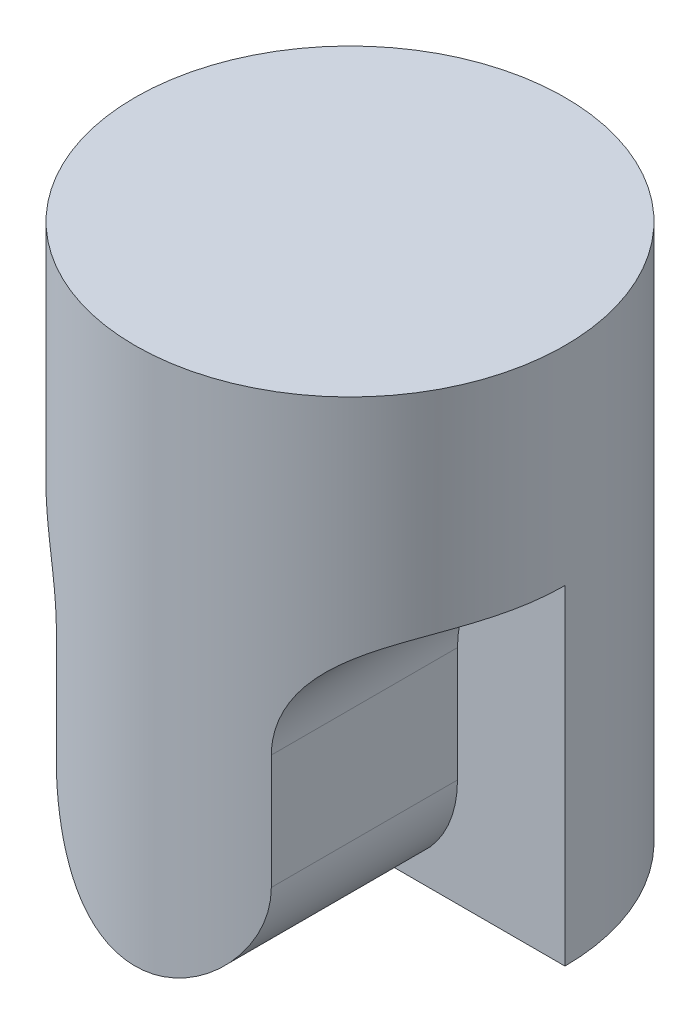
from build123d import *

# Parameters (mm, degrees)
SKETCH1_R           = 19.05
BOSS_EXTRUDE1_DEPTH = 47.625
CUT_EXTRUDE1_DEPTH  = 55.716959208


with BuildPart() as part:
    # Sketch1 → Boss-Extrude1 (new body)
    with BuildSketch(Plane(origin=(0, 0, 0), x_dir=(1, 0, 0), z_dir=(0, 1, 0))):
        with Locations(Location((0, 0, 0), (0, 0, 270))):
            Circle(SKETCH1_R)
    extrude(amount=BOSS_EXTRUDE1_DEPTH)

    # Sketch2 → Cut-Extrude1 (cut, through all)
    with BuildSketch(Plane.XY):
        with BuildLine():
            Line((-19.05, -1.366), (19.05, -1.366))
            Line((19.05, -1.366), (19.05, 29.21))
            ThreePointArc((19.05, 29.21), (12.314807909, 26.420192091), (9.525, 19.685))
            Line((9.525, 19.685), (9.525, 9.525))
            ThreePointArc((9.525, 9.525), (0, 0), (-9.525, 9.525))
            Line((-9.525, 9.525), (-9.525, 19.685))
            ThreePointArc((-9.525, 19.685), (-12.314807909, 26.420192091), (-19.05, 29.21))
            Line((-19.05, 29.21), (-19.05, -1.366))
        make_face()
    extrude(amount=CUT_EXTRUDE1_DEPTH, mode=Mode.SUBTRACT)


solid = part.part
